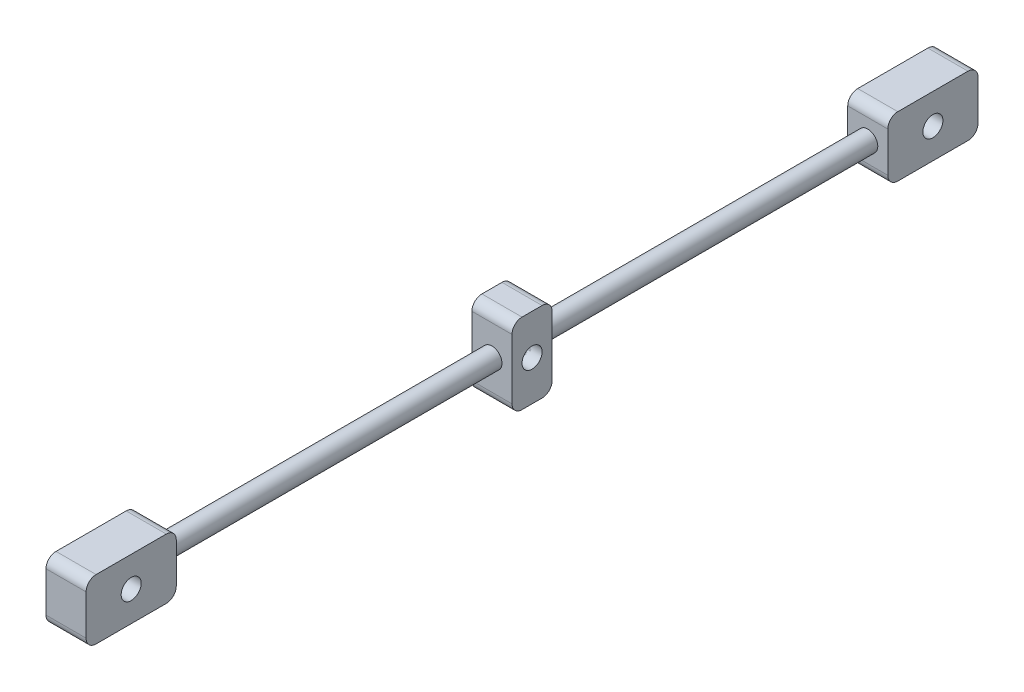
from build123d import *

# Parameters (mm, degrees)
SKETCH1_R                = 10
BOSS_EXTRUDE1_DEPTH      = 400
BOSS_EXTRUDE2_DEPTH      = 20
BOSS_EXTRUDE2_DEPTH_BACK = 20
SKETCH2_W                = 80
SKETCH2_H                = 40
SKETCH3_W                = 60
SKETCH3_H                = 90
BOSS_EXTRUDE3_DEPTH      = 20
SKETCH4_R                = 10
CUT_EXTRUDE1_DEPTH       = 54
SKETCH5_R                = 10
CUT_EXTRUDE4_DEPTH       = 54
FILLET1_R                = 10
FILLET2_R                = 10
FILLET3_R                = 10


with BuildPart() as part:
    # Sketch1 → Boss-Extrude1 (new body)
    with BuildSketch(Plane(origin=(0, 0, 0), x_dir=(0, 1, 0), z_dir=(0, 0, 1))):
        Circle(SKETCH1_R)
    boss_extrude1 = extrude(amount=BOSS_EXTRUDE1_DEPTH)

    # Mirror1: Boss-Extrude1 across plane
    add(boss_extrude1.mirror(Plane.XY))

    # Sketch3 → Boss-Extrude3 (add, symmetric)
    with BuildSketch(Plane.YZ):
        with Locations((0, -400)):
            Rectangle(SKETCH3_W, SKETCH3_H)
    boss_extrude3 = extrude(amount=BOSS_EXTRUDE3_DEPTH, both=True)

    # Mirror2: Boss-Extrude3 across plane
    add(boss_extrude3.mirror(Plane.XY))

    # Sketch4 → Cut-Extrude1 (cut)
    with BuildSketch(Plane(origin=(-20, 0, 0), x_dir=(0, -1, 0), z_dir=(-1, 0, 0))):
        with Locations((0, -400)):
            Circle(SKETCH4_R)
        with Locations((0, 400)):
            Circle(SKETCH4_R)
    extrude(amount=-CUT_EXTRUDE1_DEPTH, mode=Mode.SUBTRACT)


with BuildPart() as body_2:
    # Sketch2 → Boss-Extrude2 (new, two sides: drawn at the far end of the back side and taken through both)
    with BuildSketch(Plane.YZ.offset(-BOSS_EXTRUDE2_DEPTH_BACK)):
        Rectangle(SKETCH2_W, SKETCH2_H)
    extrude(amount=BOSS_EXTRUDE2_DEPTH + BOSS_EXTRUDE2_DEPTH_BACK)


with BuildPart() as cut_extrude4_tool:
    # Sketch5 → Cut-Extrude4 (new body)
    with BuildSketch(Plane(origin=(-20, 0, 0), x_dir=(0, -1, 0), z_dir=(-1, 0, 0))):
        Circle(SKETCH5_R)
    extrude(amount=-CUT_EXTRUDE4_DEPTH)


with BuildPart() as part_1:
    add(part.part)

    # Cut-Extrude4: cut by cut_extrude4_tool
    add(cut_extrude4_tool.part, mode=Mode.SUBTRACT)

    # Fillet1
    fillet1_edges = [part_1.edges().sort_by_distance(p)[0] for p in [
        (0, -30, -445),
        (0, 30, -445),
        (0, 30, -355),
        (0, -30, -355),
    ]]
    fillet(fillet1_edges, radius=FILLET1_R)

    # Fillet3
    fillet3_edges = [part_1.edges().sort_by_distance(p)[0] for p in [
        (0, -30, 355),
        (0, 30, 355),
        (0, -30, 445),
        (0, 30, 445),
    ]]
    fillet(fillet3_edges, radius=FILLET3_R)


with BuildPart() as body_2_1:
    add(body_2.part)

    # Cut-Extrude4: cut by cut_extrude4_tool
    add(cut_extrude4_tool.part, mode=Mode.SUBTRACT)

    # Fillet2
    fillet2_edges = [body_2_1.edges().sort_by_distance(p)[0] for p in [
        (0, -40, -20),
        (0, 40, -20),
        (0, 40, 20),
        (0, -40, 20),
    ]]
    fillet(fillet2_edges, radius=FILLET2_R)


solid = Compound([part_1.part, body_2_1.part])
